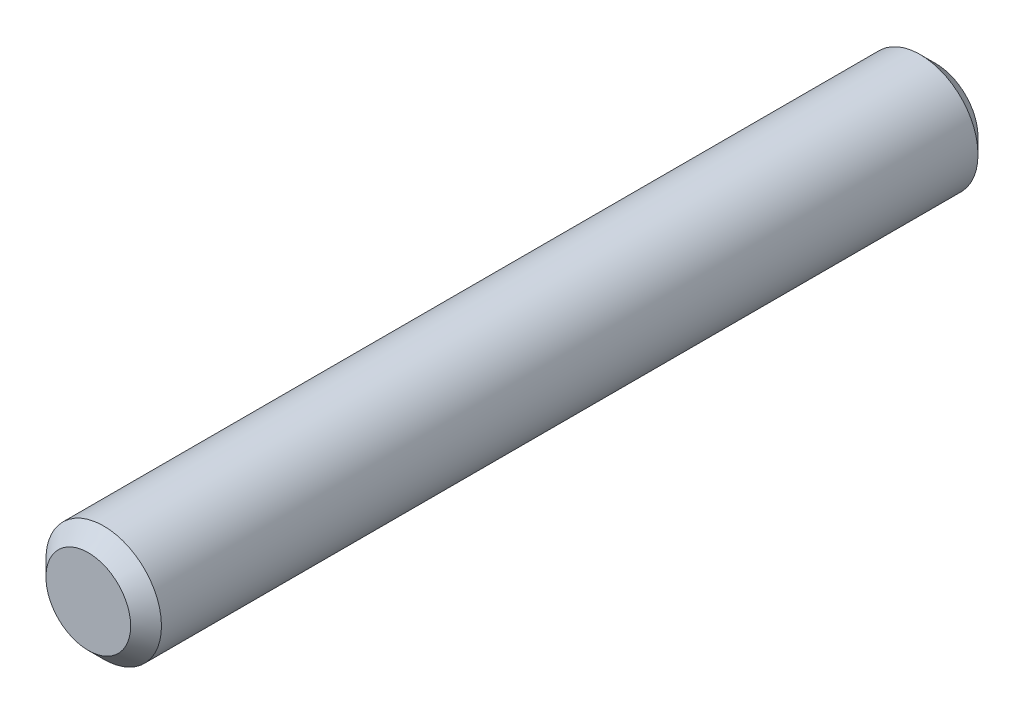
from build123d import *

# Parameters (mm, degrees)
SKETCH1_R           = 7.5
BOSS_EXTRUDE1_DEPTH = 110
CHAMFER1_SIZE       = 2


with BuildPart() as part:
    # Sketch1 → Boss-Extrude1 (new body)
    with BuildSketch(Plane.XY):
        Circle(SKETCH1_R)
    extrude(amount=BOSS_EXTRUDE1_DEPTH)

    # Chamfer1
    chamfer1_edges = [part.edges().sort_by_distance(p)[0] for p in [
        (-7.5, 0, 0),
        (-7.5, 0, 110),
    ]]
    chamfer(chamfer1_edges, length=CHAMFER1_SIZE)


solid = part.part
